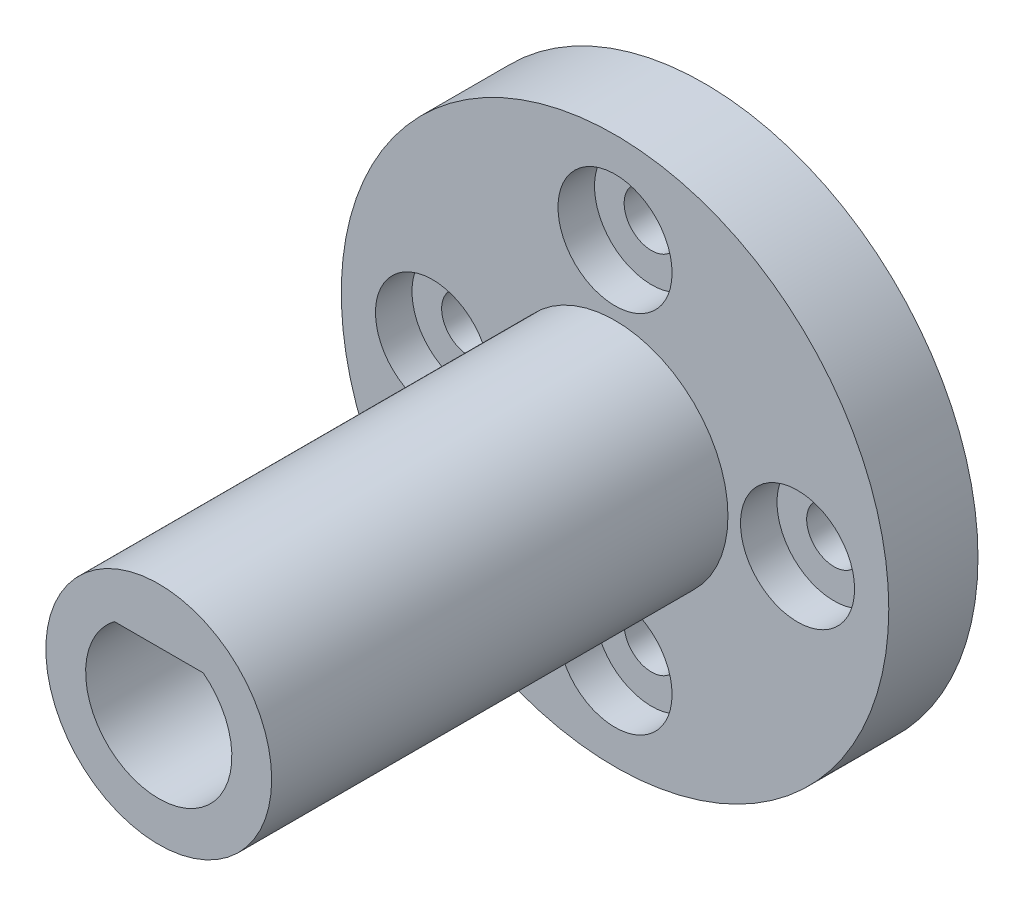
from build123d import *

# Parameters (mm, degrees)
ESQUISSE1_R                                        = 12
BOSS_EXTRU_1_DEPTH                                 = 3.91
ESQUISSE6_R                                        = 4
ENL_V_MAT_EXTRU_2_DEPTH                            = 1.91
ESQUISSE7_R                                        = 4.95
BOSS_EXTRU_2_DEPTH                                 = 20
CHAMBRAGE_POUR_VIS_T_TE_RONDE_BOMB_E_M_D           = 2.4
CHAMBRAGE_POUR_VIS_T_TE_RONDE_BOMB_E_M_CBORE_D     = 5
CHAMBRAGE_POUR_VIS_T_TE_RONDE_BOMB_E_M_CBORE_DEPTH = 1.6
R_P_TITION_CIRCULAIRE2_COUNT                       = 4


with BuildPart() as part:
    # Esquisse1 → Boss.-Extru.1 (new body)
    with BuildSketch(Plane.XY):
        Circle(ESQUISSE1_R)
    extrude(amount=BOSS_EXTRU_1_DEPTH)

    # Esquisse6 → Enlèv. mat.-Extru.2 (cut)
    with BuildSketch(Plane(origin=(0, 0, 0), x_dir=(-1, 0, 0), z_dir=(0, 0, -1))):
        Circle(ESQUISSE6_R)
    extrude(amount=-ENL_V_MAT_EXTRU_2_DEPTH, mode=Mode.SUBTRACT)

    # Esquisse7 → Boss.-Extru.2 (add)
    with BuildSketch(Plane.XY.offset(3.91)):
        Circle(ESQUISSE7_R)
        with BuildLine():
            Line((1.948075974, 2.545), (-1.948075974, 2.545))
            ThreePointArc((-1.948075974, 2.545), (0, -3.205), (1.948075974, 2.545))
        make_face(mode=Mode.SUBTRACT)
    extrude(amount=BOSS_EXTRU_2_DEPTH)

    # Chambrage pour vis à tête ronde bombée M21 (through all)
    with Locations(Plane.XY.offset(3.91)):
        with Locations((0, 8)):
            chambrage_pour_vis_t_te_ronde_bomb_e_m = CounterBoreHole(CHAMBRAGE_POUR_VIS_T_TE_RONDE_BOMB_E_M_D / 2, CHAMBRAGE_POUR_VIS_T_TE_RONDE_BOMB_E_M_CBORE_D / 2, CHAMBRAGE_POUR_VIS_T_TE_RONDE_BOMB_E_M_CBORE_DEPTH)

    # Répétition circulaire2: Chambrage pour vis à tête ronde bombée M21 ×4 about axis
    r_p_tition_circulaire2_axis = Axis((0, 0, 0), (0, 0, 1))
    for i in range(1, R_P_TITION_CIRCULAIRE2_COUNT):
        add(chambrage_pour_vis_t_te_ronde_bomb_e_m.rotate(r_p_tition_circulaire2_axis, i * 360 / R_P_TITION_CIRCULAIRE2_COUNT), mode=Mode.SUBTRACT)


solid = part.part
